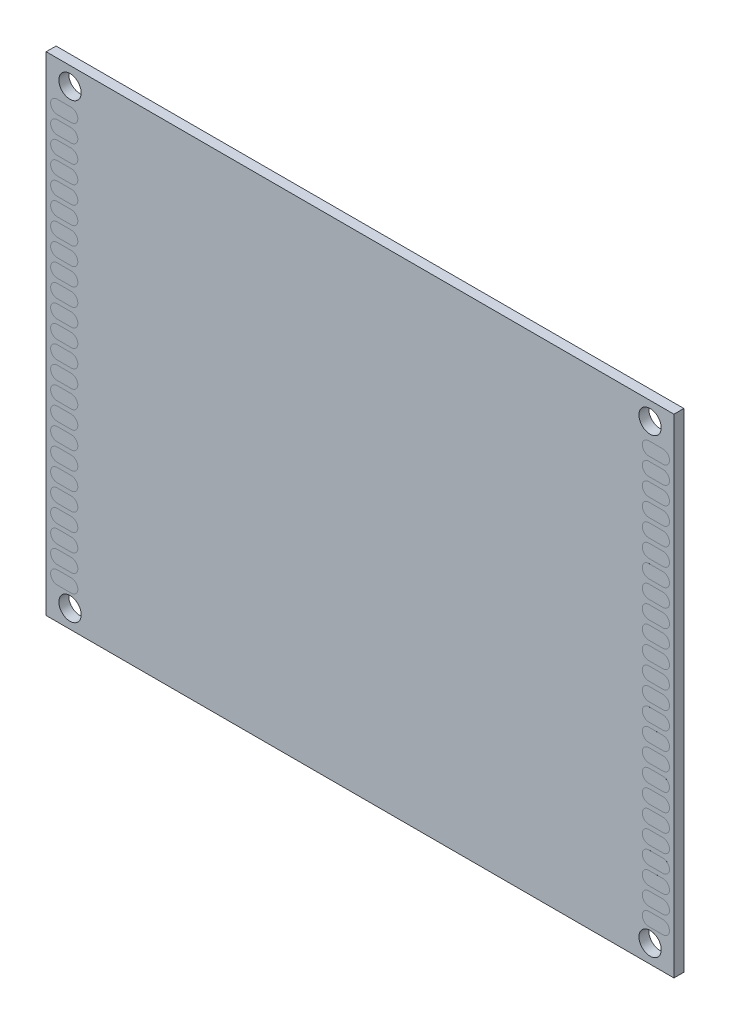
from build123d import *

# Parameters (mm, degrees)
SKETCH2_W               = 90
SKETCH2_H               = 70
BOSS_EXTRUDE1_DEPTH     = 0.71
CUT_EXTRUDE1_DEPTH      = 58.013192333
CUT_EXTRUDE1_DEPTH_BACK = 58.013192333
SKETCH3_R               = 1.6
BOSS_EXTRUDE2_START     = -0.711
BOSS_EXTRUDE2_DEPTH     = 1.4211


with BuildPart() as part:
    # Sketch2 → Boss-Extrude1 (new, symmetric)
    with BuildSketch(Plane.XY):
        Rectangle(SKETCH2_W, SKETCH2_H)
    extrude(amount=BOSS_EXTRUDE1_DEPTH, both=True)

    # Sketch3 → Cut-Extrude1 (cut, two sides: drawn at the far end of the back side and taken through both)
    with BuildSketch(Plane.XY.offset(-CUT_EXTRUDE1_DEPTH_BACK)):
        with Locations((-41.58, 32.4)):
            Circle(SKETCH3_R)
        with Locations((41.58, 32.4)):
            Circle(SKETCH3_R)
        with Locations((41.58, -32.4)):
            Circle(SKETCH3_R)
        with Locations((-41.58, -32.4)):
            Circle(SKETCH3_R)
    extrude(amount=CUT_EXTRUDE1_DEPTH + CUT_EXTRUDE1_DEPTH_BACK, mode=Mode.SUBTRACT)

    # Sketch4 → Boss-Extrude2 (add)
    with BuildSketch(Plane.XY.offset(BOSS_EXTRUDE2_START)):
        with BuildLine():
            Line((-43.41, 28), (-41.41, 28))
            ThreePointArc((-41.41, 28), (-40.46, 28.95), (-41.41, 29.9))
            Line((-41.41, 29.9), (-43.41, 29.9))
            ThreePointArc((-43.41, 29.9), (-44.36, 28.95), (-43.41, 28))
        make_face()
        with BuildLine():
            Line((-43.41, 25.46), (-41.41, 25.46))
            ThreePointArc((-41.41, 25.46), (-40.46, 26.41), (-41.41, 27.36))
            Line((-41.41, 27.36), (-43.41, 27.36))
            ThreePointArc((-43.41, 27.36), (-44.36, 26.41), (-43.41, 25.46))
        make_face()
        with BuildLine():
            Line((-43.41, 22.92), (-41.41, 22.92))
            ThreePointArc((-41.41, 22.92), (-40.46, 23.87), (-41.41, 24.82))
            Line((-41.41, 24.82), (-43.41, 24.82))
            ThreePointArc((-43.41, 24.82), (-44.36, 23.87), (-43.41, 22.92))
        make_face()
        with BuildLine():
            Line((-43.41, 20.38), (-41.41, 20.38))
            ThreePointArc((-41.41, 20.38), (-40.46, 21.33), (-41.41, 22.28))
            Line((-41.41, 22.28), (-43.41, 22.28))
            ThreePointArc((-43.41, 22.28), (-44.36, 21.33), (-43.41, 20.38))
        make_face()
        with BuildLine():
            Line((-43.41, 17.84), (-41.41, 17.84))
            ThreePointArc((-41.41, 17.84), (-40.46, 18.79), (-41.41, 19.74))
            Line((-41.41, 19.74), (-43.41, 19.74))
            ThreePointArc((-43.41, 19.74), (-44.36, 18.79), (-43.41, 17.84))
        make_face()
        with BuildLine():
            Line((-43.41, 15.3), (-41.41, 15.3))
            ThreePointArc((-41.41, 15.3), (-40.46, 16.25), (-41.41, 17.2))
            Line((-41.41, 17.2), (-43.41, 17.2))
            ThreePointArc((-43.41, 17.2), (-44.36, 16.25), (-43.41, 15.3))
        make_face()
        with BuildLine():
            Line((-43.41, 12.76), (-41.41, 12.76))
            ThreePointArc((-41.41, 12.76), (-40.46, 13.71), (-41.41, 14.66))
            Line((-41.41, 14.66), (-43.41, 14.66))
            ThreePointArc((-43.41, 14.66), (-44.36, 13.71), (-43.41, 12.76))
        make_face()
        with BuildLine():
            Line((-43.41, 10.22), (-41.41, 10.22))
            ThreePointArc((-41.41, 10.22), (-40.46, 11.17), (-41.41, 12.12))
            Line((-41.41, 12.12), (-43.41, 12.12))
            ThreePointArc((-43.41, 12.12), (-44.36, 11.17), (-43.41, 10.22))
        make_face()
        with BuildLine():
            Line((-43.41, 7.68), (-41.41, 7.68))
            ThreePointArc((-41.41, 7.68), (-40.46, 8.63), (-41.41, 9.58))
            Line((-41.41, 9.58), (-43.41, 9.58))
            ThreePointArc((-43.41, 9.58), (-44.36, 8.63), (-43.41, 7.68))
        make_face()
        with BuildLine():
            Line((-43.41, 5.14), (-41.41, 5.14))
            ThreePointArc((-41.41, 5.14), (-40.46, 6.09), (-41.41, 7.04))
            Line((-41.41, 7.04), (-43.41, 7.04))
            ThreePointArc((-43.41, 7.04), (-44.36, 6.09), (-43.41, 5.14))
        make_face()
        with BuildLine():
            Line((-43.41, 2.6), (-41.41, 2.6))
            ThreePointArc((-41.41, 2.6), (-40.46, 3.55), (-41.41, 4.5))
            Line((-41.41, 4.5), (-43.41, 4.5))
            ThreePointArc((-43.41, 4.5), (-44.36, 3.55), (-43.41, 2.6))
        make_face()
        with BuildLine():
            Line((-43.41, 0.06), (-41.41, 0.06))
            ThreePointArc((-41.41, 0.06), (-40.46, 1.01), (-41.41, 1.96))
            Line((-41.41, 1.96), (-43.41, 1.96))
            ThreePointArc((-43.41, 1.96), (-44.36, 1.01), (-43.41, 0.06))
        make_face()
        with BuildLine():
            Line((-43.41, -2.48), (-41.41, -2.48))
            ThreePointArc((-41.41, -2.48), (-40.46, -1.53), (-41.41, -0.58))
            Line((-41.41, -0.58), (-43.41, -0.58))
            ThreePointArc((-43.41, -0.58), (-44.36, -1.53), (-43.41, -2.48))
        make_face()
        with BuildLine():
            Line((-43.41, -5.02), (-41.41, -5.02))
            ThreePointArc((-41.41, -5.02), (-40.46, -4.07), (-41.41, -3.12))
            Line((-41.41, -3.12), (-43.41, -3.12))
            ThreePointArc((-43.41, -3.12), (-44.36, -4.07), (-43.41, -5.02))
        make_face()
        with BuildLine():
            Line((-43.41, -7.56), (-41.41, -7.56))
            ThreePointArc((-41.41, -7.56), (-40.46, -6.61), (-41.41, -5.66))
            Line((-41.41, -5.66), (-43.41, -5.66))
            ThreePointArc((-43.41, -5.66), (-44.36, -6.61), (-43.41, -7.56))
        make_face()
        with BuildLine():
            Line((-43.41, -10.1), (-41.41, -10.1))
            ThreePointArc((-41.41, -10.1), (-40.46, -9.15), (-41.41, -8.2))
            Line((-41.41, -8.2), (-43.41, -8.2))
            ThreePointArc((-43.41, -8.2), (-44.36, -9.15), (-43.41, -10.1))
        make_face()
        with BuildLine():
            Line((-43.41, -12.64), (-41.41, -12.64))
            ThreePointArc((-41.41, -12.64), (-40.46, -11.69), (-41.41, -10.74))
            Line((-41.41, -10.74), (-43.41, -10.74))
            ThreePointArc((-43.41, -10.74), (-44.36, -11.69), (-43.41, -12.64))
        make_face()
        with BuildLine():
            Line((-43.41, -15.18), (-41.41, -15.18))
            ThreePointArc((-41.41, -15.18), (-40.46, -14.23), (-41.41, -13.28))
            Line((-41.41, -13.28), (-43.41, -13.28))
            ThreePointArc((-43.41, -13.28), (-44.36, -14.23), (-43.41, -15.18))
        make_face()
        with BuildLine():
            Line((-43.41, -17.72), (-41.41, -17.72))
            ThreePointArc((-41.41, -17.72), (-40.46, -16.77), (-41.41, -15.82))
            Line((-41.41, -15.82), (-43.41, -15.82))
            ThreePointArc((-43.41, -15.82), (-44.36, -16.77), (-43.41, -17.72))
        make_face()
        with BuildLine():
            Line((-43.41, -20.26), (-41.41, -20.26))
            ThreePointArc((-41.41, -20.26), (-40.46, -19.31), (-41.41, -18.36))
            Line((-41.41, -18.36), (-43.41, -18.36))
            ThreePointArc((-43.41, -18.36), (-44.36, -19.31), (-43.41, -20.26))
        make_face()
        with BuildLine():
            Line((-43.41, -22.8), (-41.41, -22.8))
            ThreePointArc((-41.41, -22.8), (-40.46, -21.85), (-41.41, -20.9))
            Line((-41.41, -20.9), (-43.41, -20.9))
            ThreePointArc((-43.41, -20.9), (-44.36, -21.85), (-43.41, -22.8))
        make_face()
        with BuildLine():
            Line((-43.41, -25.34), (-41.41, -25.34))
            ThreePointArc((-41.41, -25.34), (-40.46, -24.39), (-41.41, -23.44))
            Line((-41.41, -23.44), (-43.41, -23.44))
            ThreePointArc((-43.41, -23.44), (-44.36, -24.39), (-43.41, -25.34))
        make_face()
        with BuildLine():
            Line((-43.41, -27.88), (-41.41, -27.88))
            ThreePointArc((-41.41, -27.88), (-40.46, -26.93), (-41.41, -25.98))
            Line((-41.41, -25.98), (-43.41, -25.98))
            ThreePointArc((-43.41, -25.98), (-44.36, -26.93), (-43.41, -27.88))
        make_face()
        with BuildLine():
            Line((-43.41, -30.42), (-41.41, -30.42))
            ThreePointArc((-41.41, -30.42), (-40.46, -29.47), (-41.41, -28.52))
            Line((-41.41, -28.52), (-43.41, -28.52))
            ThreePointArc((-43.41, -28.52), (-44.36, -29.47), (-43.41, -30.42))
        make_face()
    boss_extrude2 = extrude(amount=BOSS_EXTRUDE2_DEPTH)

    # Mirror1: Boss-Extrude2 across plane
    add(boss_extrude2.mirror(Plane(origin=(0, 0, 0), x_dir=(0, 0, 1), z_dir=(1, 0, 0))))


solid = part.part
